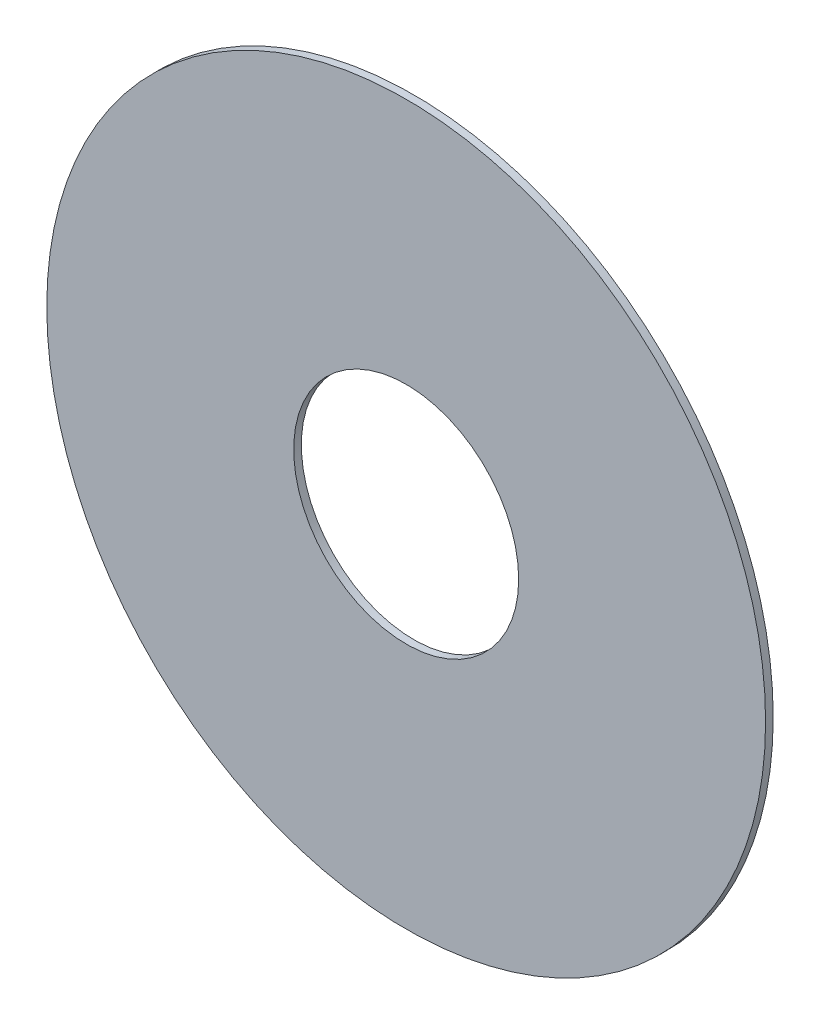
from build123d import *

# Parameters (mm, degrees)
PRINTED_GUARD_START = 45.5
SKETCH_1_R          = 94.246153846
SKETCH_1_R_2        = 29.5
PRINTED_GUARD_DEPTH = 2


with BuildPart() as part:
    # Эскиз1 → Printed_guard (new body)
    with BuildSketch(Plane.XY.offset(PRINTED_GUARD_START)):
        Circle(SKETCH_1_R)
        Circle(SKETCH_1_R_2, mode=Mode.SUBTRACT)
    extrude(amount=PRINTED_GUARD_DEPTH)


solid = part.part
